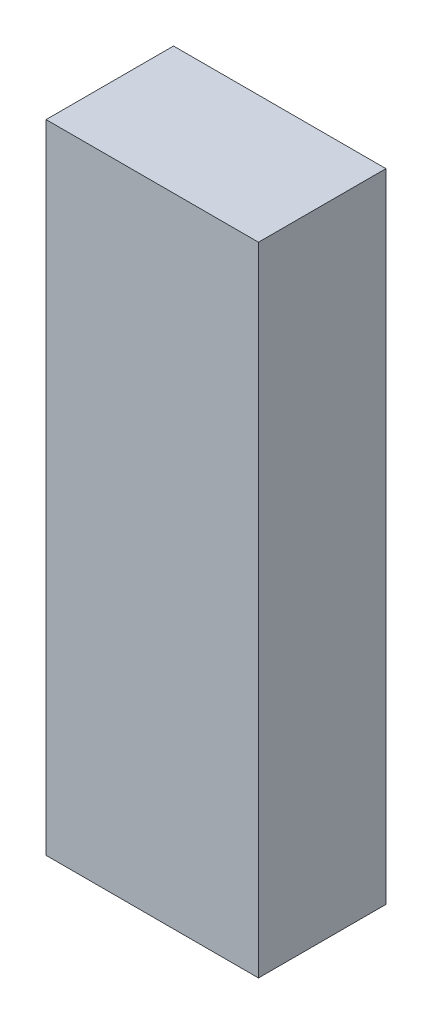
from build123d import *

# Parameters (mm, degrees)
CROQUIS1_W              = 50
CROQUIS1_H              = 150
SALIENTE_EXTRUIR1_DEPTH = 30


with BuildPart() as part:
    # Croquis1 → Saliente-Extruir1 (new body)
    with BuildSketch(Plane.XY):
        Rectangle(CROQUIS1_W, CROQUIS1_H)
    extrude(amount=SALIENTE_EXTRUIR1_DEPTH)


solid = part.part
